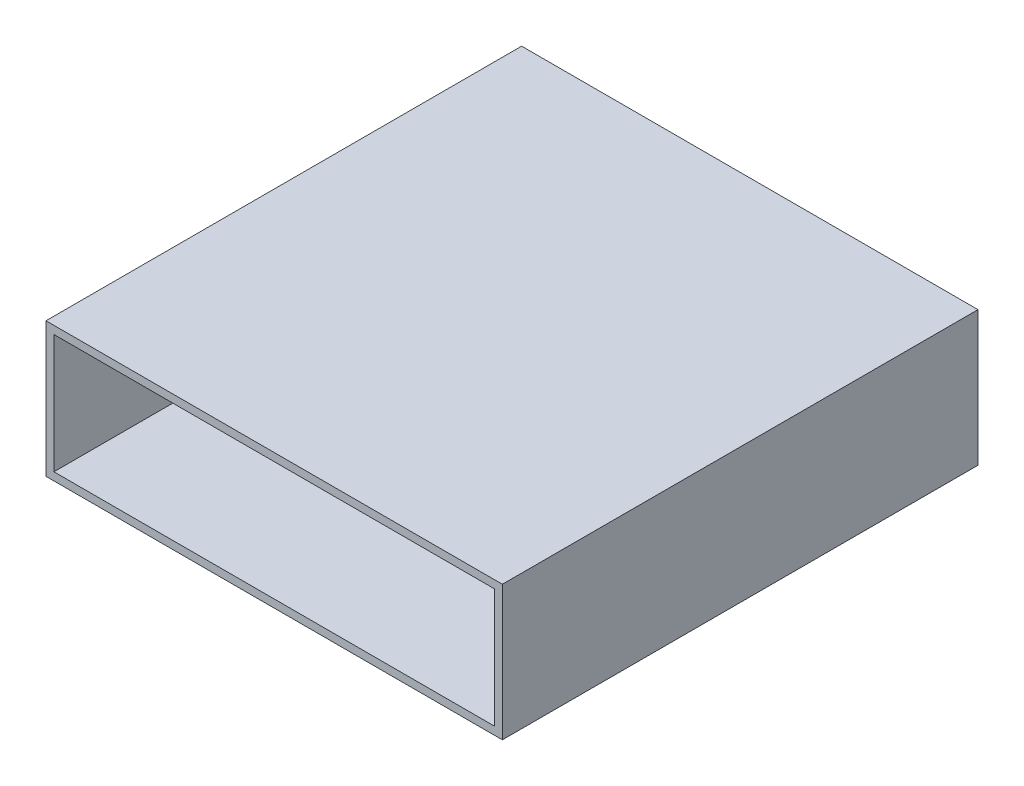
from build123d import *

# Parameters (mm, degrees)
SKETCH1_W           = 115.14
SKETCH1_H           = 34
BOSS_EXTRUDE1_DEPTH = 120
SKETCH2_W           = 111.14
SKETCH2_H           = 30
CUT_EXTRUDE1_DEPTH  = 116
SKETCH3_W           = 111.14
SKETCH3_H           = 30
CUT_EXTRUDE2_DEPTH  = 2


with BuildPart() as part:
    # Sketch1 → Boss-Extrude1 (new body)
    with BuildSketch(Plane.XY):
        with Locations((-57.57, 17)):
            Rectangle(SKETCH1_W, SKETCH1_H)
    extrude(amount=BOSS_EXTRUDE1_DEPTH)

    # Sketch2 → Cut-Extrude1 (cut)
    with BuildSketch(Plane.XY.offset(120)):
        with Locations((-57.57, 17)):
            Rectangle(SKETCH2_W, SKETCH2_H)
    extrude(amount=-CUT_EXTRUDE1_DEPTH, mode=Mode.SUBTRACT)

    # Sketch3 → Cut-Extrude2 (cut)
    with BuildSketch(Plane(origin=(0, 0, 0), x_dir=(-1, 0, 0), z_dir=(0, 0, -1))):
        with Locations((57.57, 17)):
            Rectangle(SKETCH3_W, SKETCH3_H)
    extrude(amount=-CUT_EXTRUDE2_DEPTH, mode=Mode.SUBTRACT)


solid = part.part
